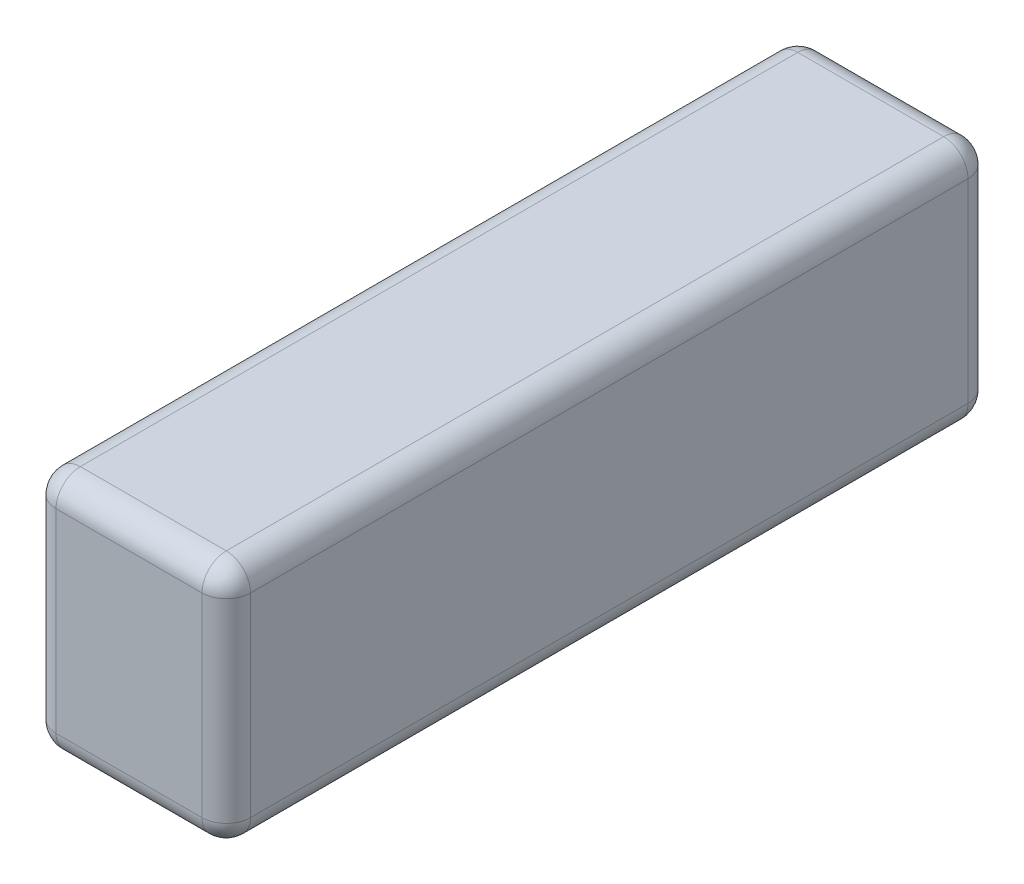
from build123d import *

# Parameters (mm, degrees)
SKETCH_1_W      = 16
SKETCH_1_H      = 20
EXTRUDE_1_DEPTH = 63
FILLET_1_R      = 2


with BuildPart() as part:
    # 草图1 → 凸台-拉伸1 (new body)
    with BuildSketch(Plane.XY):
        Rectangle(SKETCH_1_W, SKETCH_1_H)
    extrude(amount=EXTRUDE_1_DEPTH)

    # 圆角1
    fillet_1_edges = [part.edges().sort_by_distance(p)[0] for p in [
        (-8, 0, 63),
        (0, -10, 63),
        (8, 0, 63),
        (0, -10, 0),
        (-8, 0, 0),
        (0, 10, 0),
        (8, 0, 0),
        (0, 10, 63),
        (8, -10, 31.5),
        (-8, -10, 31.5),
        (-8, 10, 31.5),
        (8, 10, 31.5),
    ]]
    fillet(fillet_1_edges, radius=FILLET_1_R)


solid = part.part
